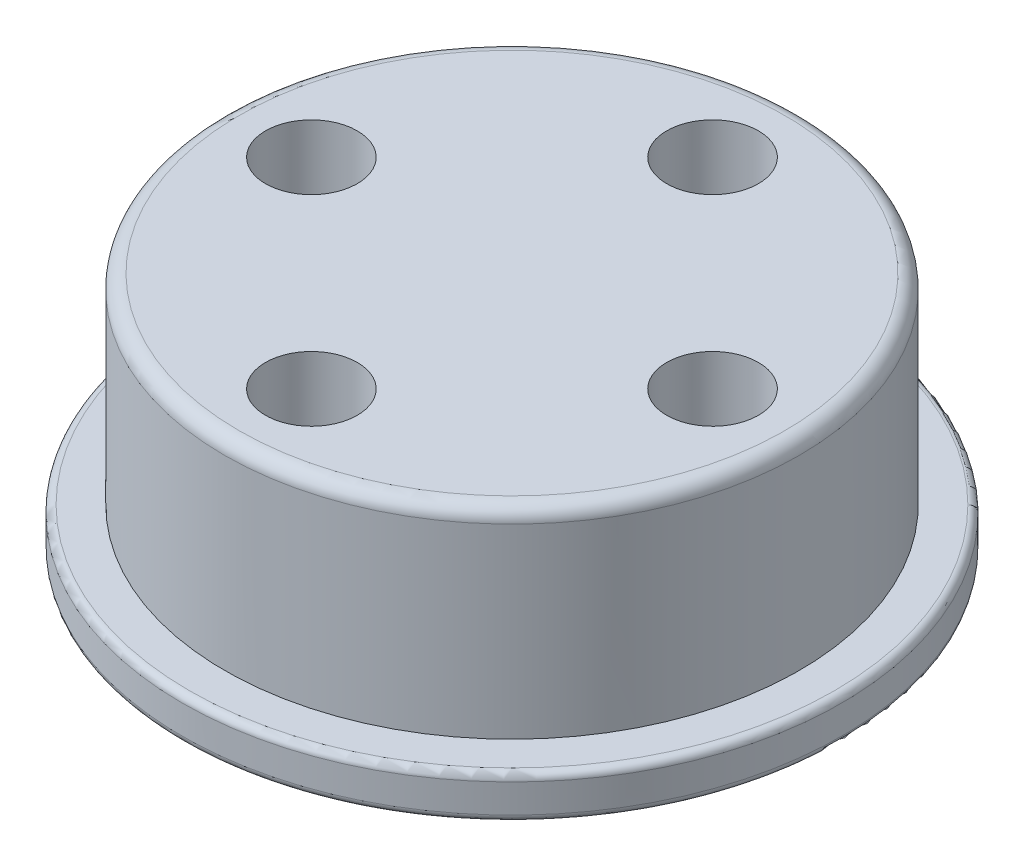
from build123d import *

# Parameters (mm, degrees)
SKETCH2_R                                       = 1.6
CUT_EXTRUDE1_DEPTH                              = 19.350749304
CSK_FOR_M3_FLAT_HEAD_MACHINE_SCREW1_D           = 2.8
CSK_FOR_M3_FLAT_HEAD_MACHINE_SCREW1_CSINK_D     = 6.5
CSK_FOR_M3_FLAT_HEAD_MACHINE_SCREW1_CSINK_ANGLE = 90
FILLET1_R                                       = 0.5
FILLET2_R                                       = 0.25


with BuildPart() as part:
    # Sketch1 → Revolve1 (revolve)
    with BuildSketch(Plane.XY, mode=Mode.PRIVATE) as revolve1_sk:
        Polygon((0, 8.5), (10.025, 8.5), (10.025, 1.5), (11.5, 1.5), (11.5, 0), (0, 0), align=None)
    revolve(revolve1_sk.sketch.rotate(Axis((0, 0, 0), (0, 1, 0)), 90), axis=Axis((0, 0, 0), (0, 1, 0)))

    # Sketch2 → Cut-Extrude1 (cut, through all)
    with BuildSketch(Plane.XZ):
        with Locations(Location((0, 7, 0), (0, 0, 270))):
            Circle(SKETCH2_R)
        with Locations(Location((7, 0, 0), (0, 0, 270))):
            Circle(SKETCH2_R)
        with Locations(Location((0, -7, 0), (0, 0, 270))):
            Circle(SKETCH2_R)
        with Locations(Location((-7, 0, 0), (0, 0, 270))):
            Circle(SKETCH2_R)
    extrude(amount=-CUT_EXTRUDE1_DEPTH, mode=Mode.SUBTRACT)

    # CSK for M3 Flat Head Machine Screw1 (through all)
    with Locations(Plane(origin=(0, 0, 7), x_dir=(0, 0, -1), z_dir=(0, -1, 0))):
        with Locations((0, 0), (7, 7), (14, 0), (7, -7)):
            CounterSinkHole(CSK_FOR_M3_FLAT_HEAD_MACHINE_SCREW1_D / 2, CSK_FOR_M3_FLAT_HEAD_MACHINE_SCREW1_CSINK_D / 2, counter_sink_angle=CSK_FOR_M3_FLAT_HEAD_MACHINE_SCREW1_CSINK_ANGLE)

    # Fillet1
    fillet1_edges = [part.edges().sort_by_distance(p)[0] for p in [
        (0, 8.5, 10.025),
    ]]
    fillet(fillet1_edges, radius=FILLET1_R)

    # Fillet2
    fillet2_edges = [part.edges().sort_by_distance(p)[0] for p in [
        (0, 0, 11.5),
        (0, 1.5, 11.5),
    ]]
    fillet(fillet2_edges, radius=FILLET2_R)


solid = part.part
